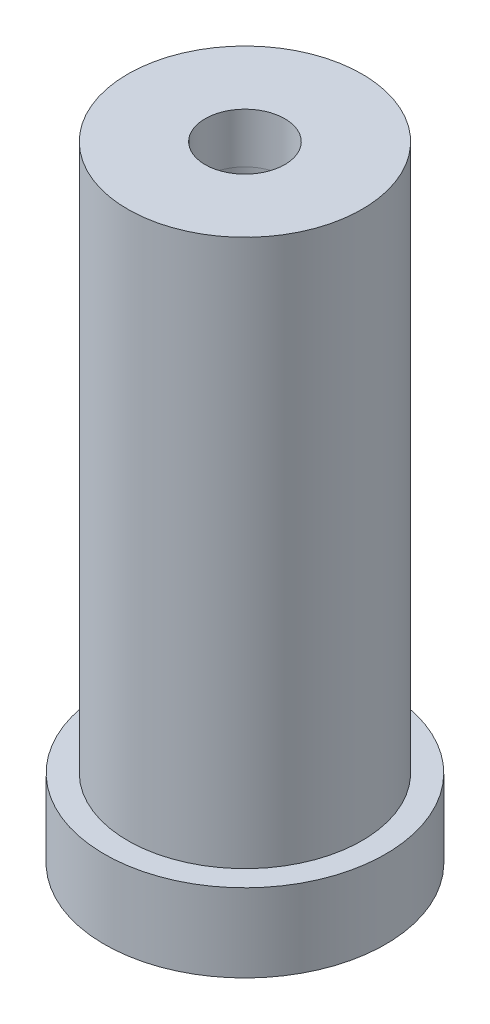
from build123d import *

# Parameters (mm, degrees)
CUT_EXTRUDE1_REACH = 43.976
SKETCH2_R          = 2.55


with BuildPart() as part:
    # Sketch1 → Revolve1 (revolve)
    with BuildSketch(Plane.XY, mode=Mode.PRIVATE) as revolve1_sk:
        Polygon((0, 0), (9, 0), (9, 5), (7.5, 5), (7.5, 40), (0, 40), align=None)
    revolve(revolve1_sk.sketch.rotate(Axis((0, 45, 0), (0, -1, 0)), 180), axis=Axis((0, 45, 0), (0, -1, 0)))

    # Sketch2 → Cut-Extrude1 (cut, up to next)
    with BuildSketch(Plane(origin=(0, 40, 0), x_dir=(1, 0, 0), z_dir=(0, 1, 0)), mode=Mode.PRIVATE) as cut_extrude1_sk1:
        with Locations(Location((0, 0, 0), (0, 0, 270))):
            Circle(SKETCH2_R)
    cut_extrude1_tool1 = extrude(cut_extrude1_sk1.sketch, amount=-CUT_EXTRUDE1_REACH, mode=Mode.PRIVATE) & part.part
    add(cut_extrude1_tool1.solids().sort_by_distance((0, 40, 0))[0], mode=Mode.SUBTRACT)

    # Cut-Sweep1: sweep along a path in Sketch5
    with BuildLine(Plane(origin=(0, 40, 0), x_dir=(1, 0, 0), z_dir=(0, 1, 0))) as cut_sweep1_path:
        CenterArc((0, 0), 2.55, 0, 360)
    # Sketch3 → Cut-Sweep1 (sweep, cut)
    with BuildSketch(Plane.XY):
        Polygon((2.55, 36.8), (3.513641914, 0), (2.55, 0), align=None)
    sweep(path=cut_sweep1_path.line, mode=Mode.SUBTRACT)


solid = part.part
